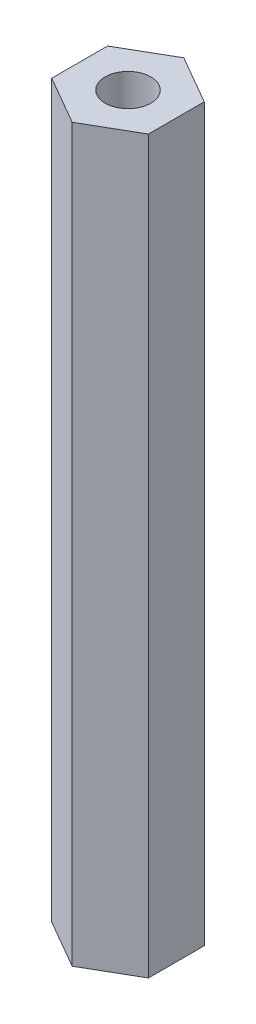
from build123d import *

# Parameters (mm, degrees)
SALIENTE_EXTRUIR1_DEPTH = 48
CROQUIS2_R              = 1.5
CORTAR_EXTRUIR1_DEPTH   = 10
CORTAR_EXTRUIR2_START   = -38
CROQUIS2_2_R            = 1.5
CORTAR_EXTRUIR2_DEPTH   = 10


with BuildPart() as part:
    # Croquis1 → Saliente-Extruir1 (new body)
    with BuildSketch(Plane(origin=(0, 0, 0), x_dir=(1, 0, 0), z_dir=(0, 1, 0))):
        Polygon((0, 3.666174209), (-3.175, 1.833087105), (-3.175, -1.833087105), (0, -3.666174209), (3.175, -1.833087105), (3.175, 1.833087105), align=None)
    extrude(amount=SALIENTE_EXTRUIR1_DEPTH)

    # Croquis2 → Cortar-Extruir1 (cut)
    with BuildSketch(Plane(origin=(0, 48, 0), x_dir=(1, 0, 0), z_dir=(0, 1, 0))):
        Circle(CROQUIS2_R)
    extrude(amount=-CORTAR_EXTRUIR1_DEPTH, mode=Mode.SUBTRACT)

    # Croquis2<2> → Cortar-Extruir2 (cut)
    with BuildSketch(Plane(origin=(0, 48, 0), x_dir=(1, 0, 0), z_dir=(0, 1, 0)).offset(CORTAR_EXTRUIR2_START)):
        Circle(CROQUIS2_2_R)
    extrude(amount=-CORTAR_EXTRUIR2_DEPTH, mode=Mode.SUBTRACT)


solid = part.part
